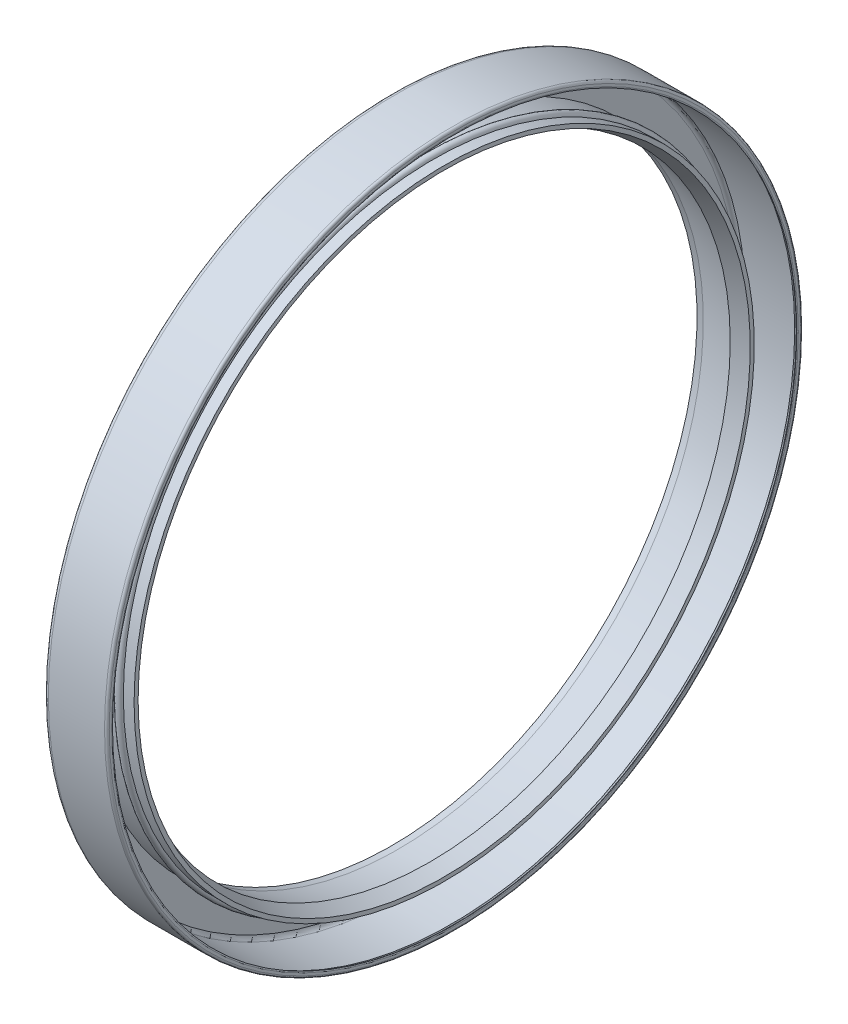
from build123d import *


with BuildPart() as part:
    # Schizzo1 → Rivoluzione1 (revolve)
    with BuildSketch(Plane.XY, mode=Mode.PRIVATE) as rivoluzione1_sk:
        with BuildLine():
            Line((0, 54.25), (0, 48.25))
            Line((0, 48.25), (1, 48.25))
            Line((1, 48.25), (6, 47.5))
            Line((6, 47.5), (8.3, 48.3625))
            Line((8.3, 48.3625), (8.3, 49))
            Line((8.3, 49), (6.6, 49))
            ThreePointArc((6.6, 49), (6, 49.6), (5.4, 49))
            Line((5.4, 49), (1, 49))
            Line((1, 49), (1, 53.65))
            ThreePointArc((1, 53.65), (1.175735931, 54.074264069), (1.6, 54.25))
            Line((1.6, 54.25), (9.4375, 54.25))
            ThreePointArc((9.4375, 54.25), (9.673528571, 54.431111092), (9.787379763, 54.15625))
            Line((9.787379763, 54.15625), (9.949759526, 54.0625))
            ThreePointArc((9.949759526, 54.0625), (9.987222185, 54.152942858), (10, 54.25))
            Line((10, 54.25), (10, 54.625))
            ThreePointArc((10, 54.625), (9.890165043, 54.890165043), (9.625, 55))
            Line((9.625, 55), (0.75, 55))
            ThreePointArc((0.75, 55), (0.219669914, 54.780330086), (0, 54.25))
        make_face()
    revolve(rivoluzione1_sk.sketch.rotate(Axis((50, 0, 0), (-1, 0, 0)), 270), axis=Axis((50, 0, 0), (-1, 0, 0)))


solid = part.part
